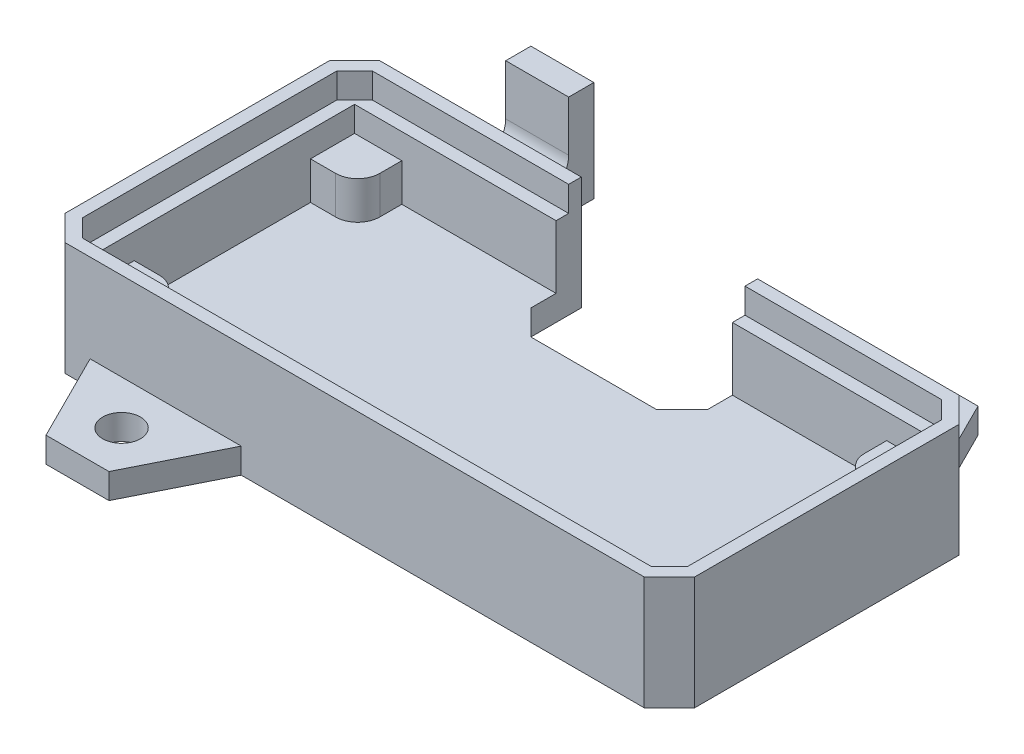
from build123d import *

# Parameters (mm, degrees)
BOSS_EXTRUDE1_DEPTH = 2
PCBLEDGE_DEPTH      = 3
BOSS_EXTRUDE3_DEPTH = 5
SKETCH4_R           = 1.5
FORSCREWS_DEPTH     = 2
GROOVE_DEPTH        = 2
SKETCH6_W           = 5
SKETCH6_H           = 8
BOSS_EXTRUDE6_DEPTH = 8
CUT_EXTRUDE1_DEPTH  = 7


with BuildPart() as part:
    # Sketch1 → Boss-Extrude1 (new body)
    with BuildSketch(Plane(origin=(0, 0, 0), x_dir=(1, 0, 0), z_dir=(0, 1, 0))):
        Polygon((-7, 12.5), (-23, 12.5), (-25, 10.5), (-25, -10.5), (-23, -12.5), (23, -12.5), (25, -10.5), (25, 10.5), (23, 12.5), (7, 12.5), (7, 8.5), (5, 6.5), (-5, 6.5), (-7, 8.5), align=None)
    extrude(amount=BOSS_EXTRUDE1_DEPTH)

    # Sketch2 → PcbLedge (add)
    with BuildSketch(Plane(origin=(0, 2, 0), x_dir=(1, 0, 0), z_dir=(0, 1, 0))):
        with BuildLine():
            Line((23, 10.5), (19.25, 10.5))
            Line((19.25, 10.5), (19.25, 8.75))
            ThreePointArc((19.25, 8.75), (19.762563133, 7.512563133), (21, 7))
            Line((21, 7), (23, 7))
            Line((23, 7), (23, 10.5))
        make_face()
        with BuildLine():
            Line((23, -10.5), (23, -7))
            Line((23, -7), (21, -7))
            ThreePointArc((21, -7), (19.762563133, -7.512563133), (19.25, -8.75))
            Line((19.25, -8.75), (19.25, -10.5))
            Line((19.25, -10.5), (23, -10.5))
        make_face()
        with BuildLine():
            Line((-23, -10.5), (-19.25, -10.5))
            Line((-19.25, -10.5), (-19.25, -8.75))
            ThreePointArc((-19.25, -8.75), (-19.762563133, -7.512563133), (-21, -7))
            Line((-21, -7), (-23, -7))
            Line((-23, -7), (-23, -10.5))
        make_face()
        with BuildLine():
            Line((-19.25, 8.75), (-19.25, 10.5))
            Line((-19.25, 10.5), (-23, 10.5))
            Line((-23, 10.5), (-23, 7))
            Line((-23, 7), (-21, 7))
            ThreePointArc((-21, 7), (-19.762563133, 7.512563133), (-19.25, 8.75))
        make_face()
    extrude(amount=PCBLEDGE_DEPTH)

    # Sketch2<3> → Boss-Extrude3 (add)
    with BuildSketch(Plane(origin=(0, 2, 0), x_dir=(1, 0, 0), z_dir=(0, 1, 0))):
        Polygon((23, 12.5), (7, 12.5), (7, 10.5), (19.25, 10.5), (23, 10.5), (23, 7), (23, -7), (23, -10.5), (19.25, -10.5), (0, -10.5), (-19.25, -10.5), (-23, -10.5), (-23, -7), (-23, 7), (-23, 10.5), (-19.25, 10.5), (-7, 10.5), (-7, 12.5), (-23, 12.5), (-25, 10.5), (-25, -10.5), (-23, -12.5), (0, -12.5), (23, -12.5), (25, -10.5), (25, 10.5), align=None)
    extrude(amount=BOSS_EXTRUDE3_DEPTH)

    # Sketch4 → ForScrews (add)
    # profile 1 of 2: a face of its own
    with BuildSketch(Plane.XZ):
        Polygon((21, -12.5), (17.5, -19.5), (12.5, -19.5), (9, -12.5), align=None)
        with Locations((15, -16)):
            Circle(SKETCH4_R, mode=Mode.SUBTRACT)
    # profile 2 of 2: a face of its own
    with BuildSketch(Plane.XZ):
        Polygon((-12.5, 19.5), (-9, 12.5), (-21, 12.5), (-17.5, 19.5), align=None)
        with Locations((-15, 16)):
            Circle(SKETCH4_R, mode=Mode.SUBTRACT)
    extrude(amount=-FORSCREWS_DEPTH)

    # Sketch5 → Groove (add)
    with BuildSketch(Plane(origin=(0, 7, 0), x_dir=(1, 0, 0), z_dir=(0, 1, 0))):
        Polygon((25, 10.5), (23, 12.5), (7, 12.5), (7, 11.5), (22.585786438, 11.5), (24, 10.085786438), (24, -10.085786438), (22.585786438, -11.5), (-22.585786438, -11.5), (-24, -10.085786438), (-24, 10.085786438), (-22.585786438, 11.5), (-7, 11.5), (-7, 12.5), (-23, 12.5), (-25, 10.5), (-25, -10.5), (-23, -12.5), (23, -12.5), (25, -10.5), align=None)
    extrude(amount=GROOVE_DEPTH)

    # Sketch6 → Boss-Extrude6 (add)
    with BuildSketch(Plane.XZ):
        with Locations((-16.5, -16.5)):
            Rectangle(SKETCH6_W, SKETCH6_H)
    extrude(amount=-BOSS_EXTRUDE6_DEPTH)

    # Sketch7 → Cut-Extrude1 (cut)
    with BuildSketch(Plane.ZY.offset(19)):
        with BuildLine():
            Line((-16.5, 2), (-12.5, 2))
            Line((-12.5, 2), (-12.5, 8.728396631))
            Line((-12.5, 8.728396631), (-18.5, 8.728396631))
            Line((-18.5, 8.728396631), (-18.5, 4))
            ThreePointArc((-18.5, 4), (-17.914213562, 2.585786438), (-16.5, 2))
        make_face()
    extrude(amount=-CUT_EXTRUDE1_DEPTH, mode=Mode.SUBTRACT)


solid = part.part
